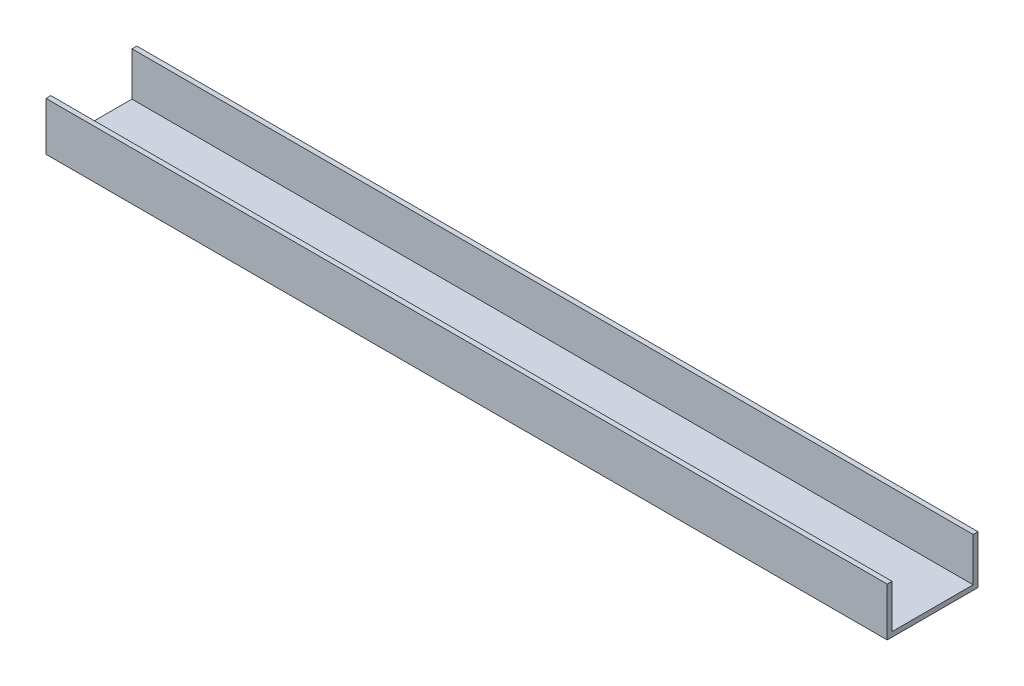
from build123d import *

# Parameters (mm, degrees)
SKETCH_1_W      = 695
SKETCH_1_H      = 75
EXTRUDE_1_DEPTH = 4
SKETCH_2_W      = 695
SKETCH_2_H      = 4
EXTRUDE_2_DEPTH = 36


with BuildPart() as part:
    # 스케치1 → 보스-돌출1 (new body)
    with BuildSketch(Plane(origin=(0, 0, 0), x_dir=(1, 0, 0), z_dir=(0, 1, 0))):
        with Locations((347.5, 37.5)):
            Rectangle(SKETCH_1_W, SKETCH_1_H)
    extrude(amount=EXTRUDE_1_DEPTH)

    # 스케치2 → 보스-돌출2 (add)
    with BuildSketch(Plane(origin=(0, 4, 0), x_dir=(1, 0, 0), z_dir=(0, 1, 0))):
        with Locations((347.5, 2)):
            Rectangle(SKETCH_2_W, SKETCH_2_H)
        with Locations((347.5, 73)):
            Rectangle(SKETCH_2_W, SKETCH_2_H)
    extrude(amount=EXTRUDE_2_DEPTH)


solid = part.part
